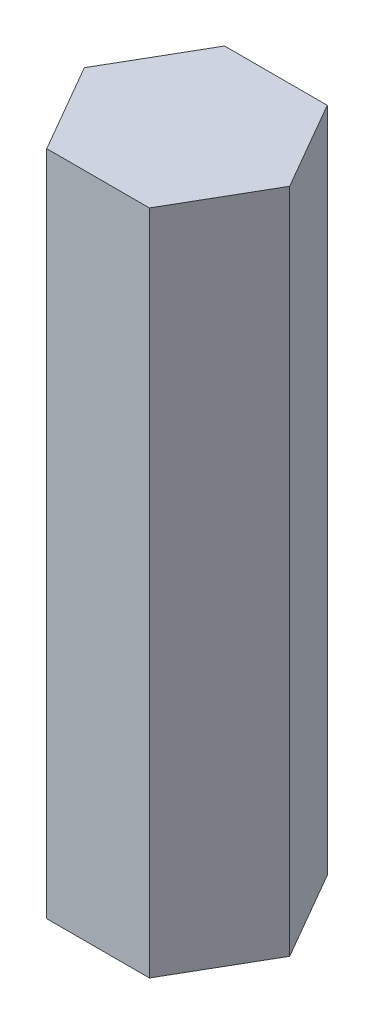
from build123d import *

# Parameters (mm, degrees)
BOSS_EXTRUDE1_DEPTH = 15


with BuildPart() as part:
    # Sketch1 → Boss-Extrude1 (new body)
    with BuildSketch(Plane(origin=(0, 0, 0), x_dir=(1, 0, 0), z_dir=(0, 1, 0))):
        Polygon((2.309401077, 0), (1.154700538, 2), (-1.154700538, 2), (-2.309401077, 0), (-1.154700538, -2), (1.154700538, -2), align=None)
    extrude(amount=BOSS_EXTRUDE1_DEPTH)


solid = part.part
